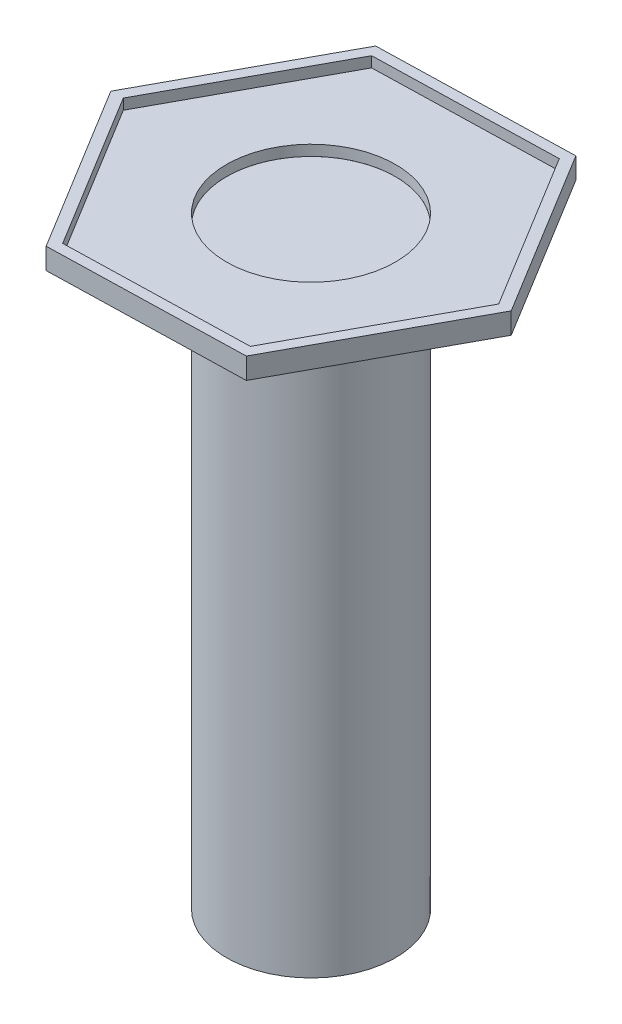
from build123d import *

# Parameters (mm, degrees)
BOSS_EXTRUDE1_DEPTH = 0.5
CUT_EXTRUDE1_DEPTH  = 0.25
SKETCH5_R           = 2
CUT_EXTRUDE4_DEPTH  = 14
SKETCH6_R           = 2
BOSS_EXTRUDE3_DEPTH = 14


with BuildPart() as part:
    # Sketch1 → Boss-Extrude1 (new body)
    with BuildSketch(Plane(origin=(0, 0, 0), x_dir=(1, 0, 0), z_dir=(0, 1, 0))):
        Polygon((-2.410657111, 3.939805278), (-4.617300012, -0.117787659), (-2.206642901, -4.057592937), (2.410657111, -3.939805278), (4.617300012, 0.117787659), (2.206642901, 4.057592937), align=None)
    extrude(amount=BOSS_EXTRUDE1_DEPTH)

    # Sketch2 → Cut-Extrude1 (cut)
    with BuildSketch(Plane(origin=(0, 0.5, 0), x_dir=(1, 0, 0), z_dir=(0, 1, 0))):
        Polygon((4.328718761, 0.11042593), (2.06872772, 3.803993378), (-2.259991041, 3.693567448), (-4.328718761, -0.11042593), (-2.06872772, -3.803993378), (2.259991041, -3.693567448), align=None)
    extrude(amount=-CUT_EXTRUDE1_DEPTH, mode=Mode.SUBTRACT)

    # Sketch5 → Cut-Extrude4 (cut)
    with BuildSketch(Plane(origin=(0, 0.25, 0), x_dir=(1, 0, 0), z_dir=(0, 1, 0))):
        with Locations(Location((0, 0, 0), (0, 0, 270))):
            Circle(SKETCH5_R)
    extrude(amount=-CUT_EXTRUDE4_DEPTH, mode=Mode.SUBTRACT)


with BuildPart() as body_2:
    # Sketch6 → Boss-Extrude3 (new body)
    with BuildSketch(Plane.XZ):
        with Locations(Location((0, 0, 0), (0, 0, 270))):
            Circle(SKETCH6_R)
    extrude(amount=BOSS_EXTRUDE3_DEPTH)


solid = Compound([part.part, body_2.part])
